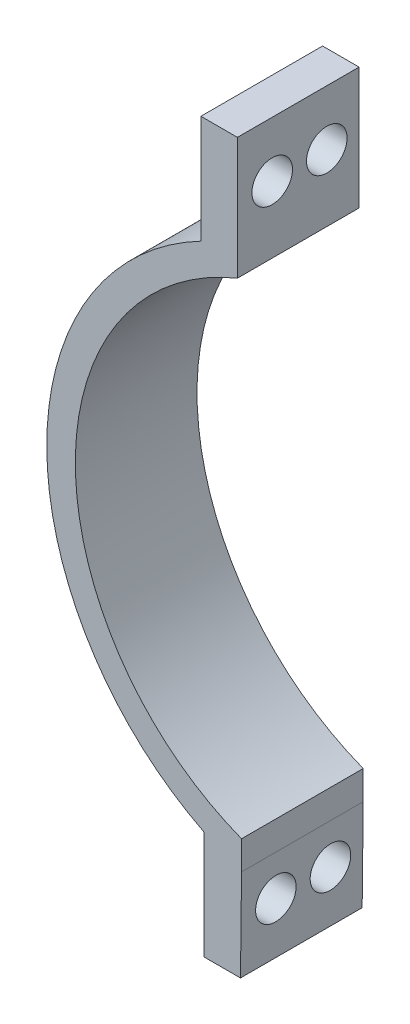
from build123d import *

# Parameters (mm, degrees)
BOSS_EXTRUDE1_DEPTH = 45
BOSS_EXTRUDE4_DEPTH = 45
BOSS_EXTRUDE5_DEPTH = 45
SKETCH9_R           = 7.5
CUT_EXTRUDE1_DEPTH  = 42.5


with BuildPart() as part:
    # Sketch3 → Boss-Extrude1 (new body)
    with BuildSketch(Plane(origin=(0, 0, 0), x_dir=(0, 1, 0), z_dir=(0, 0, 1))):
        with BuildLine():
            Line((-104.44581982, -1.529393099), (-93.813362353, -1.529393099))
            ThreePointArc((-93.813362353, -1.529393099), (-4.955593322, 59.935089755), (84.940851468, 0))
            Line((84.940851468, 0), (95.96089631, 0))
            ThreePointArc((95.96089631, 0), (-4.786263807, 70.493362274), (-104.44581982, -1.529393099))
        make_face()
    extrude(amount=BOSS_EXTRUDE1_DEPTH)

    # Sketch7 → Boss-Extrude4 (add)
    with BuildSketch(Plane(origin=(0, 95.96089631, 45), x_dir=(1, 0, 0), z_dir=(0, 0, -1))):
        Polygon((-13.5, 5.893061873), (-13.5, -34.106938127), (0, -34.106938127), (0, 0), align=None)
    extrude(amount=BOSS_EXTRUDE4_DEPTH)

    # Sketch8 → Boss-Extrude5 (add)
    with BuildSketch(Plane(origin=(1.529393099, -104.44581982, 0), x_dir=(1, 0, 0), z_dir=(0, 0, -1))):
        Polygon((-13.891184433, -5.839173076), (-13.891184433, 34.160826924), (-0.391184433, 34.160826924), (0, 0), align=None)
    extrude(amount=-BOSS_EXTRUDE5_DEPTH)

    # Sketch9 → Cut-Extrude1 (cut, symmetric)
    with BuildSketch(Plane(origin=(-12.361791334, 0, 0), x_dir=(0, -1, 0), z_dir=(-1, 0, 0))):
        with Locations((119.481769574, 11.944393397)):
            Circle(SKETCH9_R)
        with Locations((119.481769574, 32.133475773)):
            Circle(SKETCH9_R)
        with Locations((-109.597018442, 11.944393397)):
            Circle(SKETCH9_R)
        with Locations((-109.597018442, 32.133475773)):
            Circle(SKETCH9_R)
    extrude(amount=CUT_EXTRUDE1_DEPTH, both=True, mode=Mode.SUBTRACT)


solid = part.part
